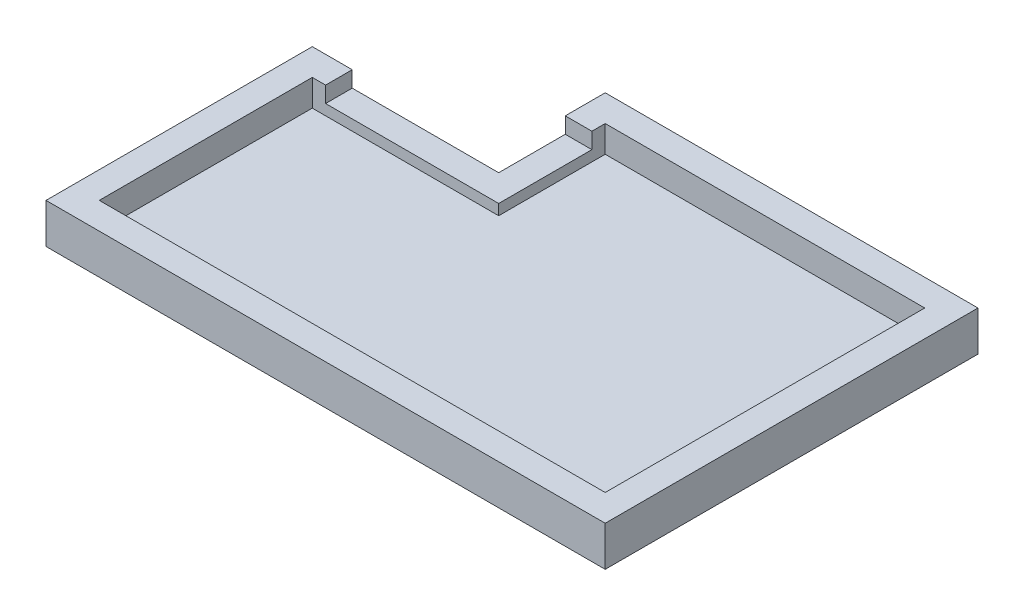
from build123d import *

# Parameters (mm, degrees)
BOSS_EXTRUDE1_DEPTH = 19.05
CUT_EXTRUDE1_DEPTH  = 12.7
CUT_EXTRUDE2_DEPTH  = 7.62


with BuildPart() as part:
    # Sketch1 → Boss-Extrude1 (new body)
    with BuildSketch(Plane(origin=(0, 0, 0), x_dir=(1, 0, 0), z_dir=(0, 1, 0))):
        Polygon((0, 0), (0, 127), (88.9, 127), (88.9, 177.8), (266.7, 177.8), (266.7, 0), align=None)
    extrude(amount=BOSS_EXTRUDE1_DEPTH)

    # Sketch2 → Cut-Extrude1 (cut)
    with BuildSketch(Plane(origin=(0, 19.05, 0), x_dir=(1, 0, 0), z_dir=(0, 1, 0))):
        Polygon((12.7, 114.3), (101.6, 114.3), (101.6, 165.1), (254, 165.1), (254, 12.7), (12.7, 12.7), align=None)
    extrude(amount=-CUT_EXTRUDE1_DEPTH, mode=Mode.SUBTRACT)

    # Sketch3 → Cut-Extrude2 (cut)
    with BuildSketch(Plane(origin=(0, 19.05, 0), x_dir=(1, 0, 0), z_dir=(0, 1, 0))):
        Polygon((19.05, 127), (19.05, 114.3), (101.6, 114.3), (101.6, 158.75), (88.9, 158.75), (88.9, 127), align=None)
    extrude(amount=-CUT_EXTRUDE2_DEPTH, mode=Mode.SUBTRACT)


solid = part.part
